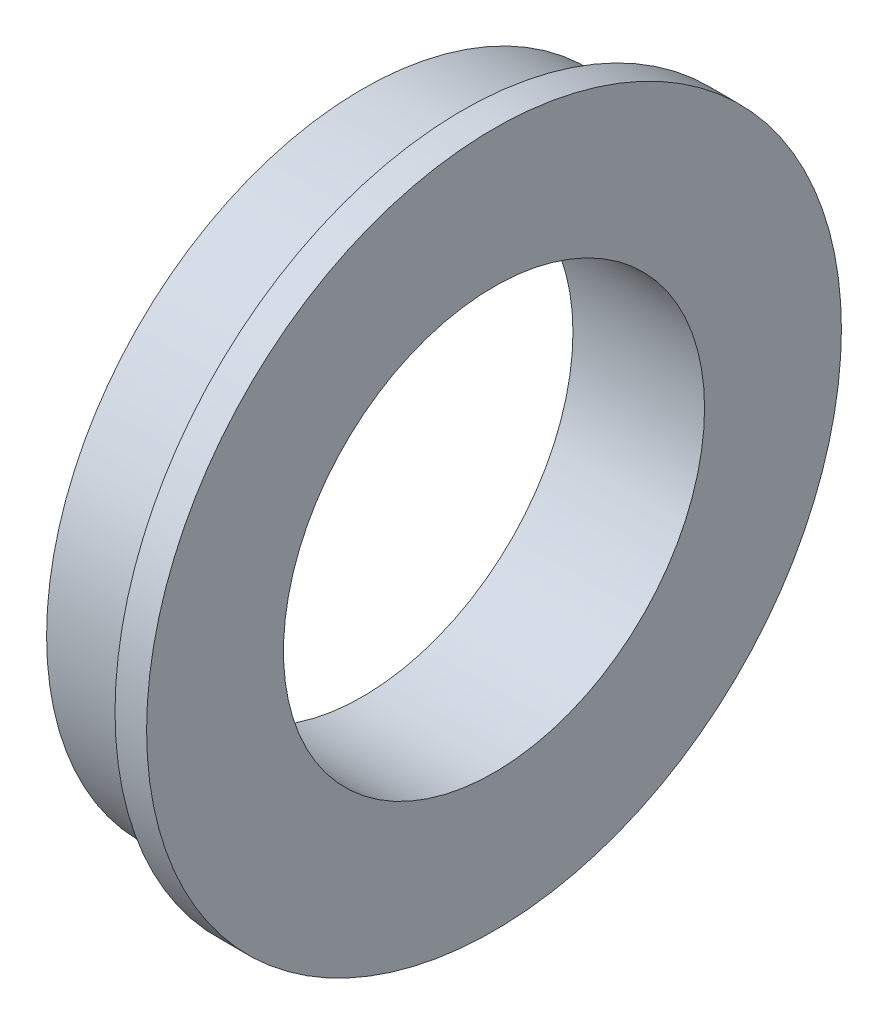
from build123d import *

# Parameters (mm, degrees)
SKETCH_1_R          = 6.6
SKETCH_1_R_2        = 4
EXTRUDE_1_DEPTH     = 2.5
SKETCH_2_R          = 8.112470545
SKETCH_2_R_2        = 6
CUT_EXTRUDE_1_DEPTH = 1.9


with BuildPart() as part:
    # 草图1 → 凸台-拉伸1 (new body)
    with BuildSketch(Plane(origin=(0, 0, 0), x_dir=(0, 0, -1), z_dir=(1, 0, 0))):
        Circle(SKETCH_1_R)
        Circle(SKETCH_1_R_2, mode=Mode.SUBTRACT)
    extrude(amount=EXTRUDE_1_DEPTH)

    # 草图2 → 切除-拉伸1 (cut)
    with BuildSketch(Plane.ZY):
        Circle(SKETCH_2_R)
        Circle(SKETCH_2_R_2, mode=Mode.SUBTRACT)
    extrude(amount=-CUT_EXTRUDE_1_DEPTH, mode=Mode.SUBTRACT)


solid = part.part
